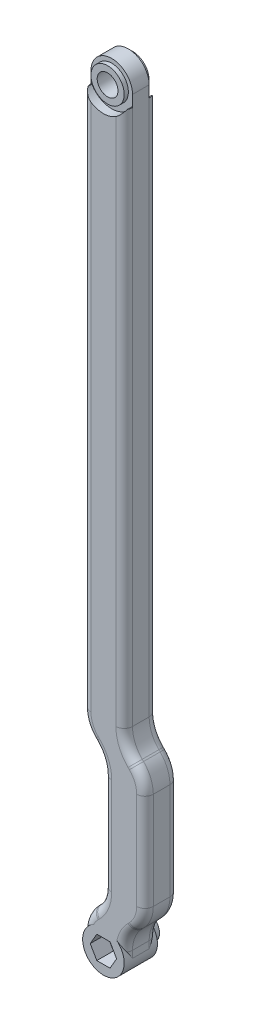
from build123d import *

# Parameters (mm, degrees)
EXTRUDE_1_DEPTH     = 8
FILLET_1_R          = 8
CUT_EXTRUDE_1_DEPTH = 1
SKETCH_3_R          = 2.5
EXTRUDE_2_DEPTH     = 4
SKETCH_4_R          = 4
CUT_EXTRUDE_3_DEPTH = 1
CUT_EXTRUDE_4_REACH = 187.596
SKETCH_5_R          = 2.5
CUT_EXTRUDE_START   = -5
SKETCH_4_2_R        = 4
CUT_EXTRUDE_5_DEPTH = 2
CUT_EXTRUDE_START_2 = -1
SKETCH_7_R          = 4
CUT_EXTRUDE_6_DEPTH = 1
FILLET_2_R          = 2
EXTRUDE_START       = -8
SKETCH_9_R          = 5
EXTRUDE_3_DEPTH     = 8
SKETCH_11_R         = 3
EXTRUDE_4_DEPTH     = 2.5
FILLET_3_R          = 1
SKETCH_12_R         = 1.6
CUT_EXTRUDE_8_DEPTH = 12
CUT_EXTRUDE_9_DEPTH = 4


with BuildPart() as part:
    # 草图1 → 凸台-拉伸1 (new body)
    with BuildSketch(Plane.XY):
        with BuildLine():
            Line((-5, -175), (-5, -180))
            ThreePointArc((-5, -180), (0, -185), (5, -180))
            Line((5, -180), (5, -175))
            Line((5, -175), (10, -170))
            Line((10, -170), (10, -140))
            Line((10, -140), (5, -135))
            Line((5, -135), (5, 0))
            ThreePointArc((5, 0), (0, 5), (-5, 0))
            Line((-5, 0), (-5, -135))
            Line((-5, -135), (0, -140))
            Line((0, -140), (0, -170))
            Line((0, -170), (-5, -175))
        make_face()
    extrude(amount=EXTRUDE_1_DEPTH)

    # 圆角1
    fillet_1_edges = [part.edges().sort_by_distance(p)[0] for p in [
        (5, -175, 4),
        (-5, -175, 4),
        (0, -170, 4),
        (0, -140, 4),
        (-5, -135, 4),
        (5, -135, 4),
        (10, -140, 4),
        (10, -170, 4),
    ]]
    fillet(fillet_1_edges, radius=FILLET_1_R)

    # 草图2 → 切除-拉伸1 (cut)
    with BuildSketch(Plane(origin=(0, 0, 0), x_dir=(-1, 0, 0), z_dir=(0, 0, -1))):
        with BuildLine():
            Line((5, 0), (5, -2.75))
            Line((5, -2.75), (4.763139721, -2.75))
            ThreePointArc((4.763139721, -2.75), (0, -5.5), (-4.763139721, -2.75))
            Line((-4.763139721, -2.75), (-5, -2.75))
            Line((-5, -2.75), (-5, 0))
            ThreePointArc((-5, 0), (0, 5), (5, 0))
        make_face()
    extrude(amount=-CUT_EXTRUDE_1_DEPTH, mode=Mode.SUBTRACT)

    # 草图3 → 凸台-拉伸2 (add)
    with BuildSketch(Plane(origin=(0, 0, 1), x_dir=(-1, 0, 0), z_dir=(0, 0, -1))):
        with Locations(Location((0, 0, 0), (0, 0, 180))):
            Circle(SKETCH_3_R)
    extrude(amount=EXTRUDE_2_DEPTH)

    # 草图4 → 切除-拉伸3 (cut)
    with BuildSketch(Plane(origin=(0, 0, 1), x_dir=(-1, 0, 0), z_dir=(0, 0, -1))):
        with BuildLine():
            Line((-5, 0), (-5, -2.75))
            Line((-5, -2.75), (-4.763139721, -2.75))
            ThreePointArc((-4.763139721, -2.75), (0, -5.5), (4.763139721, -2.75))
            Line((4.763139721, -2.75), (5, -2.75))
            Line((5, -2.75), (5, 0))
            ThreePointArc((5, 0), (0, 5), (-5, 0))
        make_face()
        Circle(SKETCH_4_R, mode=Mode.SUBTRACT)
    extrude(amount=-CUT_EXTRUDE_3_DEPTH, mode=Mode.SUBTRACT)

    # 草图5 → 切除-拉伸4 (cut, up to next)
    with BuildSketch(Plane.XY.offset(8), mode=Mode.PRIVATE) as cut_extrude_4_sk1:
        Circle(SKETCH_5_R)
    cut_extrude_4_tool1 = extrude(cut_extrude_4_sk1.sketch, amount=-CUT_EXTRUDE_4_REACH, mode=Mode.PRIVATE) & part.part
    add(cut_extrude_4_tool1.solids().sort_by_distance((0, 0, 8))[0], mode=Mode.SUBTRACT)

    # 草图4<2> → 切除-拉伸5 (cut)
    with BuildSketch(Plane(origin=(0, 0, 1), x_dir=(-1, 0, 0), z_dir=(0, 0, -1)).offset(CUT_EXTRUDE_START)):
        with BuildLine():
            Line((-5, 0), (-5, -2.75))
            Line((-5, -2.75), (-4.763139721, -2.75))
            ThreePointArc((-4.763139721, -2.75), (0, -5.5), (4.763139721, -2.75))
            Line((4.763139721, -2.75), (5, -2.75))
            Line((5, -2.75), (5, 0))
            ThreePointArc((5, 0), (0, 5), (-5, 0))
        make_face()
        Circle(SKETCH_4_2_R, mode=Mode.SUBTRACT)
    extrude(amount=-CUT_EXTRUDE_5_DEPTH, mode=Mode.SUBTRACT)

    # 草图7 → 切除-拉伸6 (cut)
    with BuildSketch(Plane.XY.offset(8).offset(CUT_EXTRUDE_START_2)):
        Circle(SKETCH_7_R)
    extrude(amount=CUT_EXTRUDE_6_DEPTH, mode=Mode.SUBTRACT)

    # 圆角2
    fillet_2_edges = [part.edges().sort_by_distance(p)[0] for p in [
        (-4.39103626, -134.74775896, 0),
        (-2.5, -137.5, 0),
        (-0.60896374, -140.25224104, 0),
        (0, -155, 0),
        (-0.60896374, -169.74775896, 0),
        (-2.5, -172.5, 0),
        (-4.39103626, -175.25224104, 0),
        (-5, -179.156854249, 0),
        (0, -185, 0),
        (5, -179.156854249, 0),
        (5.60896374, -175.25224104, 0),
        (7.5, -172.5, 0),
        (9.39103626, -169.74775896, 0),
        (10, -155, 0),
        (9.39103626, -140.25224104, 0),
        (7.5, -137.5, 0),
        (5.60896374, -134.74775896, 0),
        (-4.39103626, -134.74775896, 8),
        (-2.5, -137.5, 8),
        (-0.60896374, -140.25224104, 8),
        (0, -155, 8),
        (-0.60896374, -169.74775896, 8),
        (-2.5, -172.5, 8),
        (-4.39103626, -175.25224104, 8),
        (-5, -179.156854249, 8),
        (0, -185, 8),
        (5, -179.156854249, 8),
        (5.60896374, -175.25224104, 8),
        (7.5, -172.5, 8),
        (9.39103626, -169.74775896, 8),
        (10, -155, 8),
        (9.39103626, -140.25224104, 8),
        (7.5, -137.5, 8),
        (5.60896374, -134.74775896, 8),
        (-5, -67.218145751, 0),
        (5, -67.218145751, 0),
        (-5, -67.218145751, 8),
        (5, -67.218145751, 8),
    ]]
    fillet(fillet_2_edges, radius=FILLET_2_R)

    # 草图9 → 凸台-拉伸3 (add)
    with BuildSketch(Plane.XY.offset(8).offset(EXTRUDE_START)):
        with Locations((0, -180)):
            Circle(SKETCH_9_R)
    extrude(amount=EXTRUDE_3_DEPTH)

    # 草图11 → 凸台-拉伸4 (add)
    with BuildSketch(Plane(origin=(0, 0, 0), x_dir=(-1, 0, 0), z_dir=(0, 0, -1))):
        with Locations((0, -180)):
            Circle(SKETCH_11_R)
    extrude(amount=EXTRUDE_4_DEPTH)

    # 圆角3
    fillet_3_edges = [part.edges().sort_by_distance(p)[0] for p in [
        (3, -180, 0),
    ]]
    fillet(fillet_3_edges, radius=FILLET_3_R)

    # 草图12 → 切除-拉伸8 (cut)
    with BuildSketch(Plane(origin=(0, 0, -2.5), x_dir=(-1, 0, 0), z_dir=(0, 0, -1))):
        with Locations((0, -180)):
            Circle(SKETCH_12_R)
    extrude(amount=-CUT_EXTRUDE_8_DEPTH, mode=Mode.SUBTRACT)

    # 草图13 → 切除-拉伸9 (cut)
    with BuildSketch(Plane.XY.offset(8)):
        Polygon((-1.58771324, -177.25), (-3.175426481, -180), (-1.58771324, -182.75), (1.58771324, -182.75), (3.175426481, -180), (1.58771324, -177.25), align=None)
    extrude(amount=-CUT_EXTRUDE_9_DEPTH, mode=Mode.SUBTRACT)


solid = part.part
